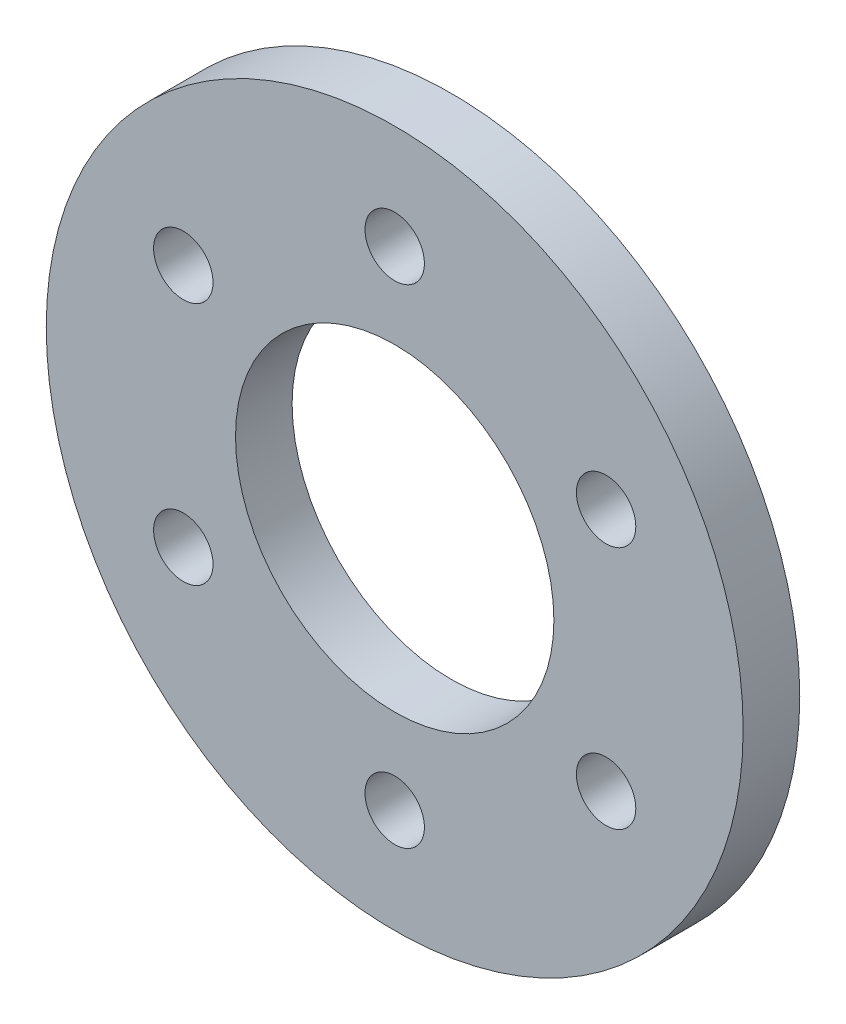
from build123d import *
from build123d.topology import SkipClean

# Parameters (mm, degrees)
SKETCH_1_R          = 44
SKETCH_1_R_2        = 11.25
SKETCH_1_R_3        = 2.1
EXTRUDE_1_DEPTH     = 4
SKETCH_2_OUTSIDE_W  = 114.904
SKETCH_2_OUTSIDE_H  = 114.904
SKETCH_2_OUTSIDE_R  = 24.625
CUT_EXTRUDE_1_DEPTH = 10


with BuildPart() as part:
    # 草图1 → 凸台-拉伸1 (new body)
    with BuildSketch(Plane.XY):
        Circle(SKETCH_1_R)
        Circle(SKETCH_1_R_2, mode=Mode.SUBTRACT)
        with Locations((0, 17.25)):
            Circle(SKETCH_1_R_3, mode=Mode.SUBTRACT)
        with Locations((14.938938215, 8.625)):
            Circle(SKETCH_1_R_3, mode=Mode.SUBTRACT)
        with Locations((14.938938215, -8.625)):
            Circle(SKETCH_1_R_3, mode=Mode.SUBTRACT)
        with Locations((0, -17.25)):
            Circle(SKETCH_1_R_3, mode=Mode.SUBTRACT)
        with Locations((-14.938938215, -8.625)):
            Circle(SKETCH_1_R_3, mode=Mode.SUBTRACT)
        with Locations((-14.938938215, 8.625)):
            Circle(SKETCH_1_R_3, mode=Mode.SUBTRACT)
        with BuildLine():
            ThreePointArc((23.542096205, 28.056377729), (0, 36.625), (-23.542096205, 28.056377729))
            ThreePointArc((-23.542096205, 28.056377729), (-24.281637205, 19.603385412), (-15.828644889, 18.863844412))
            ThreePointArc((-15.828644889, 18.863844412), (0, 24.625), (15.828644889, 18.863844412))
            ThreePointArc((15.828644889, 18.863844412), (24.281637205, 19.603385412), (23.542096205, 28.056377729))
        make_face(mode=Mode.SUBTRACT)
        with BuildLine():
            ThreePointArc((12.526487749, -34.416242236), (31.718180414, -18.3125), (36.068583954, 6.359864507))
            ThreePointArc((36.068583954, 6.359864507), (29.11784837, 11.226821959), (24.250890918, 4.276086375))
            ThreePointArc((24.250890918, 4.276086375), (21.325875568, -12.3125), (8.422246029, -23.139930787))
            ThreePointArc((8.422246029, -23.139930787), (4.836211165, -30.830207372), (12.526487749, -34.416242236))
        make_face(mode=Mode.SUBTRACT)
        with BuildLine():
            ThreePointArc((-36.068583954, 6.359864507), (-31.718180414, -18.3125), (-12.526487749, -34.416242236))
            ThreePointArc((-12.526487749, -34.416242236), (-4.836211165, -30.830207372), (-8.422246029, -23.139930787))
            ThreePointArc((-8.422246029, -23.139930787), (-21.325875568, -12.3125), (-24.250890918, 4.276086375))
            ThreePointArc((-24.250890918, 4.276086375), (-29.11784837, 11.226821959), (-36.068583954, 6.359864507))
        make_face(mode=Mode.SUBTRACT)
    extrude(amount=EXTRUDE_1_DEPTH)

    # 草图2 outside → 切除-拉伸1 (cut)
    with SkipClean():  # the faces are left unmerged after this step: merging them gives an invalid solid
        with BuildSketch(Plane.XY.offset(4)):
            Rectangle(SKETCH_2_OUTSIDE_W, SKETCH_2_OUTSIDE_H)
            Circle(SKETCH_2_OUTSIDE_R, mode=Mode.SUBTRACT)
        extrude(amount=-CUT_EXTRUDE_1_DEPTH, mode=Mode.SUBTRACT)


solid = part.part
